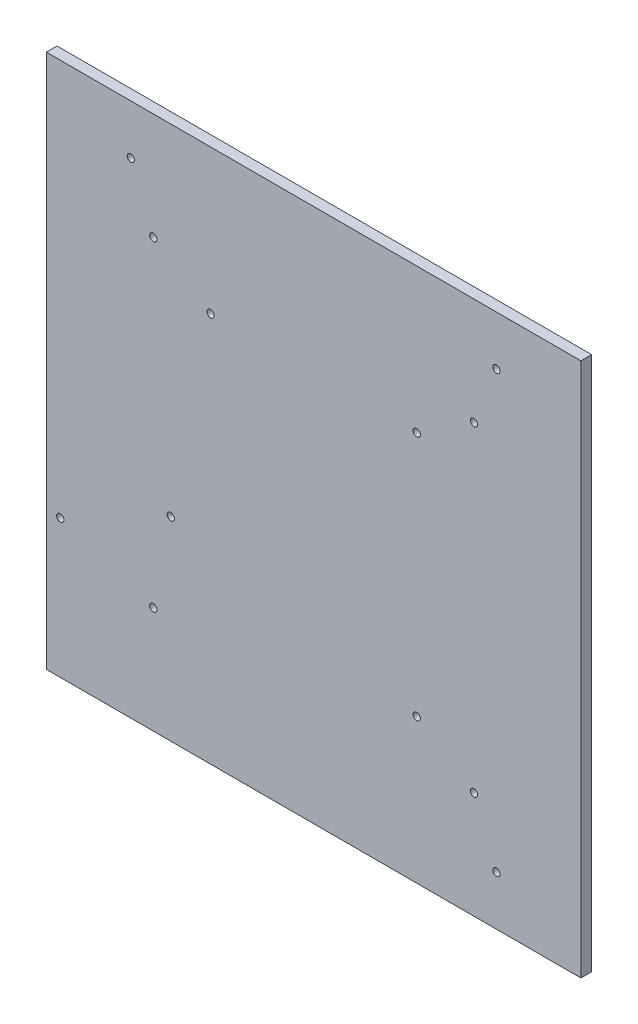
from build123d import *

# Parameters (mm, degrees)
SKETCH_1_W      = 500
SKETCH_1_H      = 500
EXTRUDE_1_DEPTH = 10
M8X1_25_2_D     = 6.8
M8X1_25_1_D     = 6.8


with BuildPart() as part:
    # ｽｹｯﾁ1 → ﾎﾞｽ - 押し出し1 (new body)
    with BuildSketch(Plane.XY):
        Rectangle(SKETCH_1_W, SKETCH_1_H)
    extrude(amount=EXTRUDE_1_DEPTH)

    # M8x1.25 ねじ穴2 (through all)
    with Locations(Plane(origin=(-150, 150, 10), x_dir=(1, 0, 0), z_dir=(0, 0, 1))):
        with Locations((0, 0), (300, 0), (0, -300), (300, -300)):
            Hole(M8X1_25_2_D / 2)

    # M8x1.25 ねじ穴1 (through all)
    with Locations(Plane(origin=(-96.418141453, 114.906666468, 10), x_dir=(1, 0, 0), z_dir=(0, 0, 1))):
        with Locations((0, 0), (192.836282906, 0), (192.836282906, -229.813332936), (-37.232837175, -183.005241429), (-74.563362724, 88.861155402), (267.39964563, 88.861155402), (-140.589593981, -235.668139399), (267.39964563, -318.674488338)):
            Hole(M8X1_25_1_D / 2)


solid = part.part
